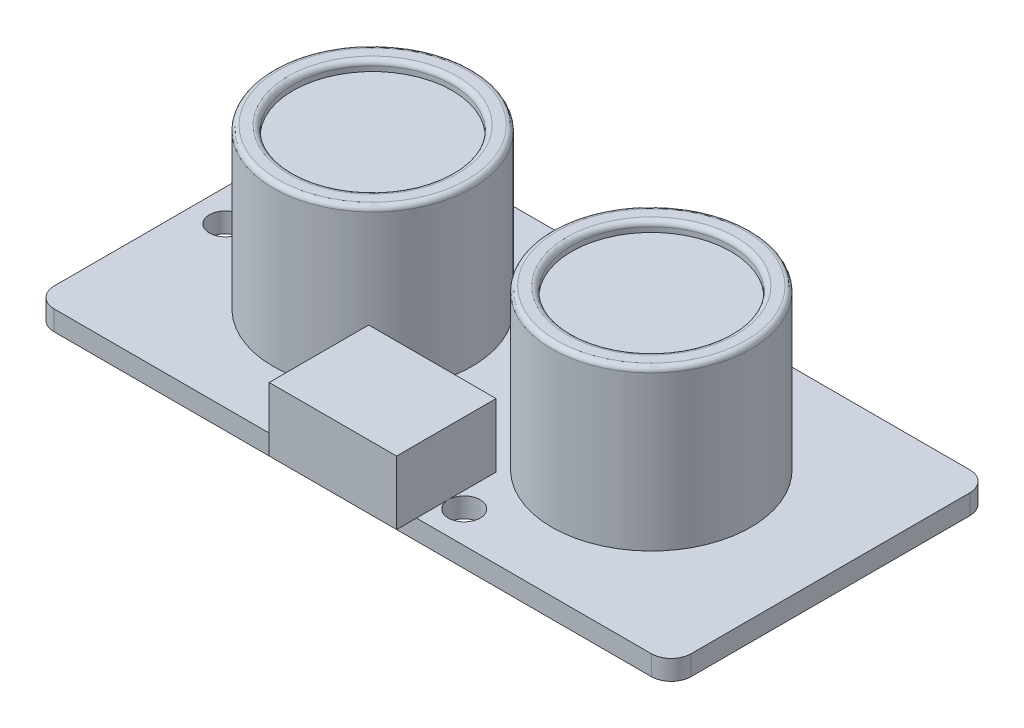
from build123d import *

# Parameters (mm, degrees)
SKETCH5_W           = 50.8
SKETCH5_H           = 25.4
BOSS_EXTRUDE4_DEPTH = 1.5875
FILLET1_R           = 1.5875
SKETCH6_R           = 1.27
CUT_EXTRUDE1_DEPTH  = 29.442400677
SKETCH7_R           = 7.9375
BOSS_EXTRUDE5_DEPTH = 12.7
SKETCH8_R           = 6.35
CUT_EXTRUDE2_DEPTH  = 0.79375
FILLET2_R           = 0.396875
SKETCH9_W           = 10.16
SKETCH9_H           = 7.9375
BOSS_EXTRUDE6_DEPTH = 5.08
SKETCH10_R          = 0.426470585
SKETCH10_R_2        = 0.479624958
SKETCH10_R_3        = 0.577856792
SKETCH10_R_4        = 0.481547326
SKETCH10_W          = 3.81
SKETCH10_H          = 10.16
SKETCH10_W_2        = 8.89
SKETCH10_H_2        = 3.81
BOSS_EXTRUDE7_DEPTH = 1.5875


with BuildPart() as part:
    # Sketch5 → Boss-Extrude4 (new body)
    with BuildSketch(Plane(origin=(0, 0, 0), x_dir=(1, 0, 0), z_dir=(0, 1, 0))):
        Rectangle(SKETCH5_W, SKETCH5_H)
    extrude(amount=-BOSS_EXTRUDE4_DEPTH)

    # Fillet1
    fillet1_edges = [part.edges().sort_by_distance(p)[0] for p in [
        (25.4, -0.79375, 12.7),
        (-25.4, -0.79375, 12.7),
        (-25.4, -0.79375, -12.7),
        (25.4, -0.79375, -12.7),
    ]]
    fillet(fillet1_edges, radius=FILLET1_R)

    # Sketch6 → Cut-Extrude1 (cut, through all)
    with BuildSketch(Plane(origin=(0, 0, 0), x_dir=(1, 0, 0), z_dir=(0, 1, 0))):
        with Locations(Location((-22.86, 0, 0), (0, 0, 270))):
            Circle(SKETCH6_R)
        with Locations(Location((6.35, 10.16, 0), (0, 0, 270))):
            Circle(SKETCH6_R)
        with Locations(Location((6.35, -10.16, 0), (0, 0, 270))):
            Circle(SKETCH6_R)
    extrude(amount=-CUT_EXTRUDE1_DEPTH, mode=Mode.SUBTRACT)

    # Sketch7 → Boss-Extrude5 (add)
    with BuildSketch(Plane(origin=(0, 0, 0), x_dir=(1, 0, 0), z_dir=(0, 1, 0))):
        with Locations(Location((11.1125, 0, 0), (0, 0, 90))):
            Circle(SKETCH7_R)
        with Locations(Location((-11.1125, 0, 0), (0, 0, 90))):
            Circle(SKETCH7_R)
    extrude(amount=BOSS_EXTRUDE5_DEPTH)

    # Sketch8 → Cut-Extrude2 (cut)
    with BuildSketch(Plane(origin=(0, 12.7, 0), x_dir=(1, 0, 0), z_dir=(0, 1, 0))):
        with Locations(Location((-11.1125, 0, 0), (0, 0, 270))):
            Circle(SKETCH8_R)
        with Locations(Location((11.1125, 0, 0), (0, 0, 270))):
            Circle(SKETCH8_R)
    extrude(amount=-CUT_EXTRUDE2_DEPTH, mode=Mode.SUBTRACT)

    # Fillet2
    fillet2_edges = [part.edges().sort_by_distance(p)[0] for p in [
        (11.1125, 12.7, 7.9375),
        (-11.1125, 12.7, 7.9375),
        (-11.1125, 12.7, -6.35),
        (11.1125, 12.7, -6.35),
    ]]
    fillet(fillet2_edges, radius=FILLET2_R)

    # Sketch9 → Boss-Extrude6 (add)
    with BuildSketch(Plane(origin=(0, 0, 0), x_dir=(1, 0, 0), z_dir=(0, 1, 0))):
        with Locations((0, -10.31875)):
            Rectangle(SKETCH9_W, SKETCH9_H)
    extrude(amount=BOSS_EXTRUDE6_DEPTH)

    # Sketch10 → Boss-Extrude7 (add)
    with BuildSketch(Plane.XZ.offset(1.5875)):
        with Locations(Location((-11.075588504, 7.114058657, 0), (0, 0, 270))):
            Circle(SKETCH10_R)
        with Locations(Location((-11.1125, -7.019355369, 0), (0, 0, 270))):
            Circle(SKETCH10_R_2)
        with Locations(Location((11.3645169, -7.019355369, 0), (0, 0, 270))):
            Circle(SKETCH10_R_3)
        with Locations(Location((11.3645169, 7.114058657, 0), (0, 0, 270))):
            Circle(SKETCH10_R_4)
        with Locations((-17.362669173, 0)):
            Rectangle(SKETCH10_W, SKETCH10_H)
        with Locations((16.820766285, 0)):
            Rectangle(SKETCH10_W_2, SKETCH10_H_2)
        with Locations((-3.443063383, -4.515309272)):
            Rectangle(SKETCH10_W_2, SKETCH10_H_2)
    extrude(amount=BOSS_EXTRUDE7_DEPTH)


solid = part.part
